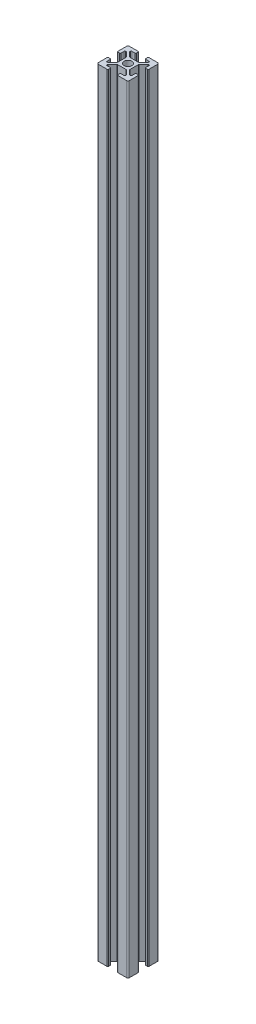
from build123d import *

# Parameters (mm, degrees)
SKETCH1_R           = 2.5
BOSS_EXTRUDE1_DEPTH = 500


with BuildPart() as part:
    # Sketch1 → Boss-Extrude1 (new body)
    with BuildSketch(Plane(origin=(0, 0, 0), x_dir=(1, 0, 0), z_dir=(0, 1, 0))):
        with BuildLine():
            Line((10, 9), (10, 3.5))
            ThreePointArc((10, 3.5), (9.853553391, 3.146446609), (9.5, 3))
            Line((9.5, 3), (8.5, 3))
            ThreePointArc((8.5, 3), (8.146446609, 3.146446609), (8, 3.5))
            Line((8, 3.5), (8, 5.5))
            ThreePointArc((8, 5.5), (7.853553391, 5.853553391), (7.5, 6))
            Line((7.5, 6), (7.267766953, 6))
            ThreePointArc((7.267766953, 6), (7.076425237, 5.961939766), (6.914213562, 5.853553391))
            Line((6.914213562, 5.853553391), (4.146446609, 3.085786438))
            ThreePointArc((4.146446609, 3.085786438), (4.038060234, 2.923574763), (4, 2.732233047))
            Line((4, 2.732233047), (4, -2.732233047))
            ThreePointArc((4, -2.732233047), (4.038060234, -2.923574763), (4.146446609, -3.085786438))
            Line((4.146446609, -3.085786438), (6.914213562, -5.853553391))
            ThreePointArc((6.914213562, -5.853553391), (7.076425237, -5.961939766), (7.267766953, -6))
            Line((7.267766953, -6), (7.5, -6))
            ThreePointArc((7.5, -6), (7.853553391, -5.853553391), (8, -5.5))
            Line((8, -5.5), (8, -3.5))
            ThreePointArc((8, -3.5), (8.146446609, -3.146446609), (8.5, -3))
            Line((8.5, -3), (9.5, -3))
            ThreePointArc((9.5, -3), (9.853553391, -3.146446609), (10, -3.5))
            Line((10, -3.5), (10, -9))
            ThreePointArc((10, -9), (9.707106781, -9.707106781), (9, -10))
            Line((9, -10), (3.5, -10))
            ThreePointArc((3.5, -10), (3.146446609, -9.853553391), (3, -9.5))
            Line((3, -9.5), (3, -8.5))
            ThreePointArc((3, -8.5), (3.146446609, -8.146446609), (3.5, -8))
            Line((3.5, -8), (5.5, -8))
            ThreePointArc((5.5, -8), (5.853553391, -7.853553391), (6, -7.5))
            Line((6, -7.5), (6, -7.267766953))
            ThreePointArc((6, -7.267766953), (5.961939766, -7.076425237), (5.853553391, -6.914213562))
            Line((5.853553391, -6.914213562), (3.085786438, -4.146446609))
            ThreePointArc((3.085786438, -4.146446609), (2.923574763, -4.038060234), (2.732233047, -4))
            Line((2.732233047, -4), (-2.732233047, -4))
            ThreePointArc((-2.732233047, -4), (-2.923574763, -4.038060234), (-3.085786438, -4.146446609))
            Line((-3.085786438, -4.146446609), (-5.853553391, -6.914213562))
            ThreePointArc((-5.853553391, -6.914213562), (-5.961939766, -7.076425237), (-6, -7.267766953))
            Line((-6, -7.267766953), (-6, -7.5))
            ThreePointArc((-6, -7.5), (-5.853553391, -7.853553391), (-5.5, -8))
            Line((-5.5, -8), (-3.5, -8))
            ThreePointArc((-3.5, -8), (-3.146446609, -8.146446609), (-3, -8.5))
            Line((-3, -8.5), (-3, -9.5))
            ThreePointArc((-3, -9.5), (-3.146446609, -9.853553391), (-3.5, -10))
            Line((-3.5, -10), (-9, -10))
            ThreePointArc((-9, -10), (-9.707106781, -9.707106781), (-10, -9))
            Line((-10, -9), (-10, -3.5))
            ThreePointArc((-10, -3.5), (-9.853553391, -3.146446609), (-9.5, -3))
            Line((-9.5, -3), (-8.5, -3))
            ThreePointArc((-8.5, -3), (-8.146446609, -3.146446609), (-8, -3.5))
            Line((-8, -3.5), (-8, -5.5))
            ThreePointArc((-8, -5.5), (-7.853553391, -5.853553391), (-7.5, -6))
            Line((-7.5, -6), (-7.267766953, -6))
            ThreePointArc((-7.267766953, -6), (-7.076425237, -5.961939766), (-6.914213562, -5.853553391))
            Line((-6.914213562, -5.853553391), (-4.146446609, -3.085786438))
            ThreePointArc((-4.146446609, -3.085786438), (-4.038060234, -2.923574763), (-4, -2.732233047))
            Line((-4, -2.732233047), (-4, 2.732233047))
            ThreePointArc((-4, 2.732233047), (-4.038060234, 2.923574763), (-4.146446609, 3.085786438))
            Line((-4.146446609, 3.085786438), (-6.914213562, 5.853553391))
            ThreePointArc((-6.914213562, 5.853553391), (-7.076425237, 5.961939766), (-7.267766953, 6))
            Line((-7.267766953, 6), (-7.5, 6))
            ThreePointArc((-7.5, 6), (-7.853553391, 5.853553391), (-8, 5.5))
            Line((-8, 5.5), (-8, 3.5))
            ThreePointArc((-8, 3.5), (-8.146446609, 3.146446609), (-8.5, 3))
            Line((-8.5, 3), (-9.5, 3))
            ThreePointArc((-9.5, 3), (-9.853553391, 3.146446609), (-10, 3.5))
            Line((-10, 3.5), (-10, 9))
            ThreePointArc((-10, 9), (-9.707106781, 9.707106781), (-9, 10))
            Line((-9, 10), (-3.5, 10))
            ThreePointArc((-3.5, 10), (-3.146446609, 9.853553391), (-3, 9.5))
            Line((-3, 9.5), (-3, 8.5))
            ThreePointArc((-3, 8.5), (-3.146446609, 8.146446609), (-3.5, 8))
            Line((-3.5, 8), (-5.5, 8))
            ThreePointArc((-5.5, 8), (-5.853553391, 7.853553391), (-6, 7.5))
            Line((-6, 7.5), (-6, 7.267766953))
            ThreePointArc((-6, 7.267766953), (-5.961939766, 7.076425237), (-5.853553391, 6.914213562))
            Line((-5.853553391, 6.914213562), (-3.085786438, 4.146446609))
            ThreePointArc((-3.085786438, 4.146446609), (-2.923574763, 4.038060234), (-2.732233047, 4))
            Line((-2.732233047, 4), (2.732233047, 4))
            ThreePointArc((2.732233047, 4), (2.923574763, 4.038060234), (3.085786438, 4.146446609))
            Line((3.085786438, 4.146446609), (5.853553391, 6.914213562))
            ThreePointArc((5.853553391, 6.914213562), (5.961939766, 7.076425237), (6, 7.267766953))
            Line((6, 7.267766953), (6, 7.5))
            ThreePointArc((6, 7.5), (5.853553391, 7.853553391), (5.5, 8))
            Line((5.5, 8), (3.5, 8))
            ThreePointArc((3.5, 8), (3.146446609, 8.146446609), (3, 8.5))
            Line((3, 8.5), (3, 9.5))
            ThreePointArc((3, 9.5), (3.146446609, 9.853553391), (3.5, 10))
            Line((3.5, 10), (9, 10))
            ThreePointArc((9, 10), (9.707106781, 9.707106781), (10, 9))
        make_face()
        with Locations(Location((0, 0, 0), (0, 0, 270))):
            Circle(SKETCH1_R, mode=Mode.SUBTRACT)
    extrude(amount=BOSS_EXTRUDE1_DEPTH)


solid = part.part
